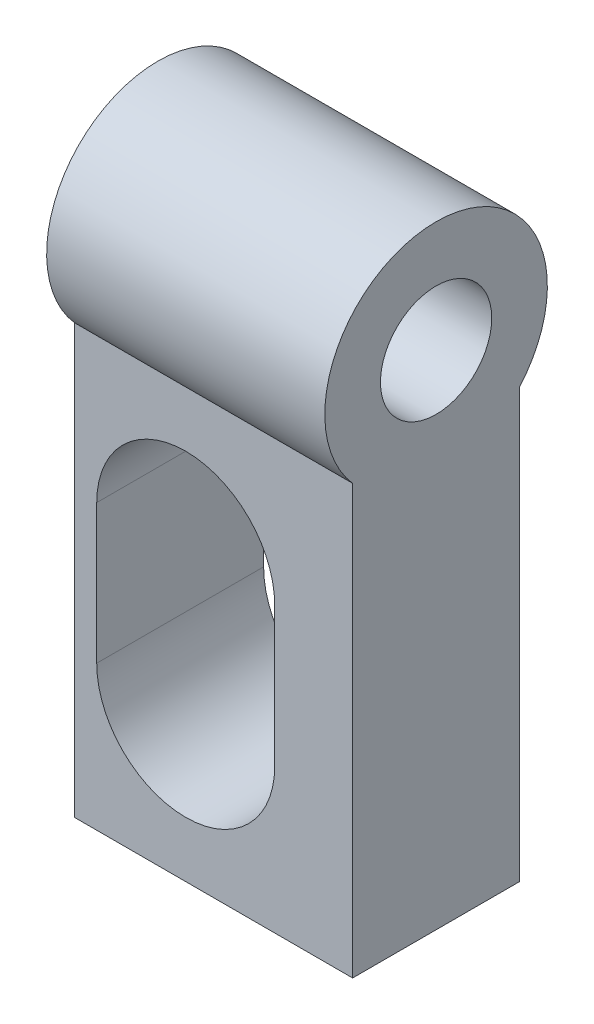
from build123d import *

# Parameters (mm, degrees)
SKETCH1_R           = 1
BOSS_EXTRUDE1_DEPTH = 5
CUT_EXTRUDE1_DEPTH  = 13.599753478


with BuildPart() as part:
    # Sketch1 → Boss-Extrude1 (new body)
    with BuildSketch(Plane(origin=(0, 0, 0), x_dir=(0, 0, -1), z_dir=(1, 0, 0))):
        with BuildLine():
            ThreePointArc((0, 7.7), (1.5, 11.022875656), (3, 7.7))
            Line((3, 7.7), (3, 0))
            Line((3, 0), (0, 0))
            Line((0, 0), (0, 7.7))
        make_face()
        with Locations((1.5, 9.022875656)):
            Circle(SKETCH1_R, mode=Mode.SUBTRACT)
    extrude(amount=BOSS_EXTRUDE1_DEPTH)

    # Sketch2 → Cut-Extrude1 (cut, through all)
    with BuildSketch(Plane(origin=(0, 0, -3), x_dir=(-1, 0, 0), z_dir=(0, 0, -1))):
        with BuildLine():
            Line((-0.4, 5.1), (-0.4, 2.6))
            ThreePointArc((-0.4, 2.6), (-2, 1), (-3.6, 2.6))
            Line((-3.6, 2.6), (-3.6, 5.1))
            ThreePointArc((-3.6, 5.1), (-2, 6.7), (-0.4, 5.1))
        make_face()
    extrude(amount=-CUT_EXTRUDE1_DEPTH, mode=Mode.SUBTRACT)


solid = part.part
